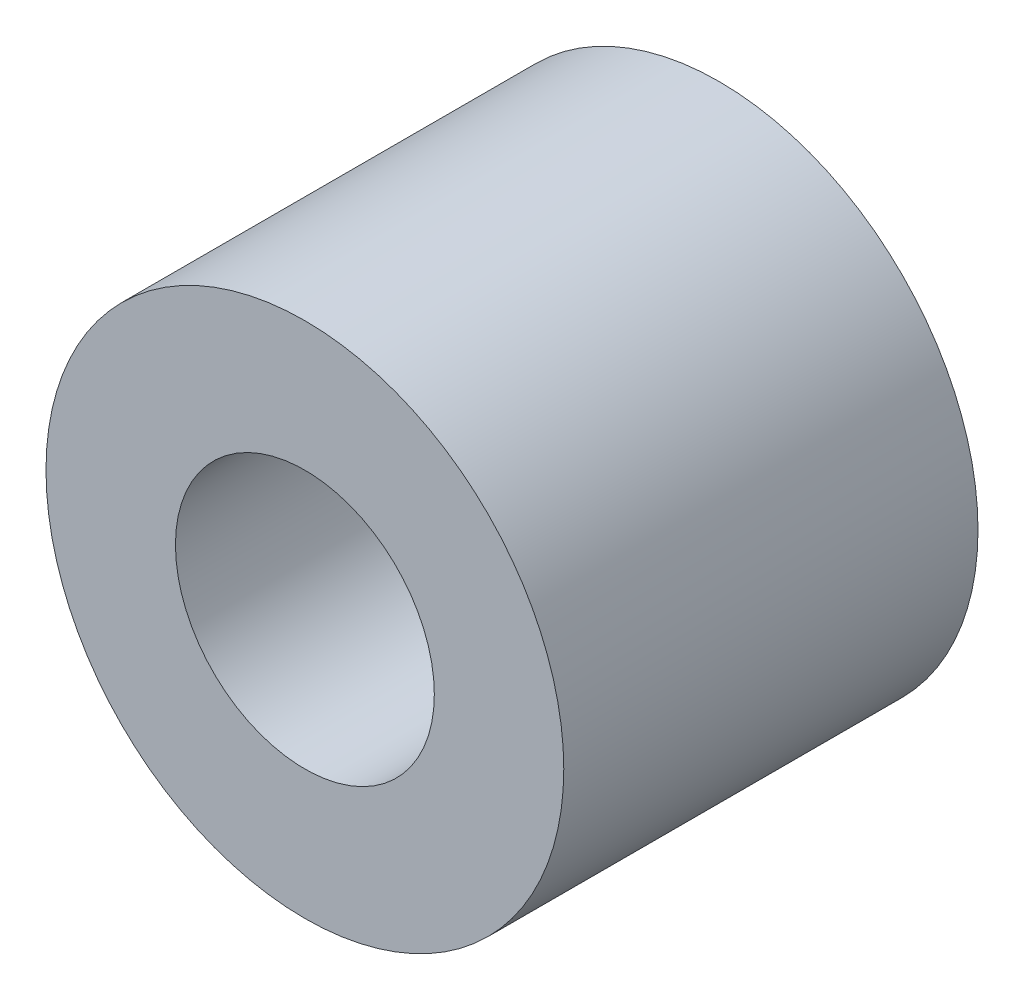
from build123d import *

# Parameters (mm, degrees)
SKETCH1_R           = 6.35
SKETCH1_R_2         = 3.175
BOSS_EXTRUDE1_DEPTH = 10.16


with BuildPart() as part:
    # Sketch1 → Boss-Extrude1 (new body)
    with BuildSketch(Plane.XY):
        with Locations((0, 15.875)):
            Circle(SKETCH1_R)
        with Locations((0, 15.875)):
            Circle(SKETCH1_R_2, mode=Mode.SUBTRACT)
    extrude(amount=BOSS_EXTRUDE1_DEPTH)


solid = part.part
